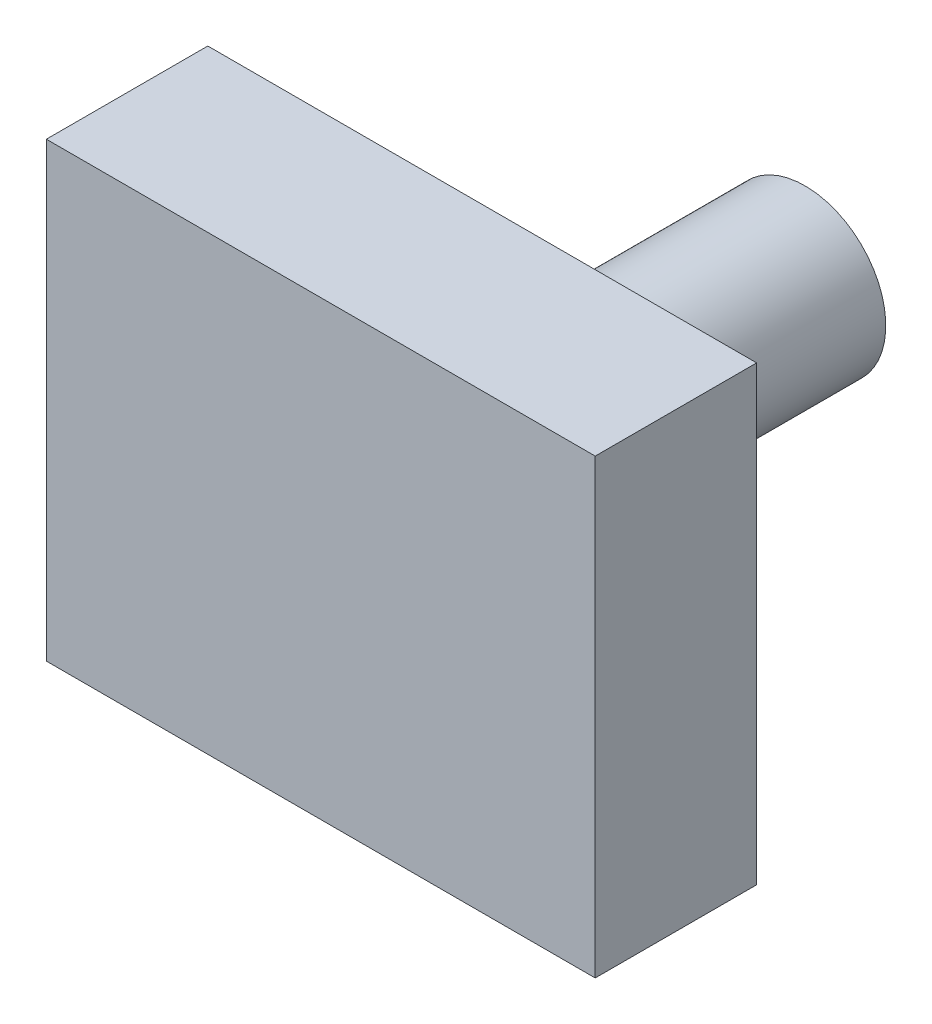
from build123d import *

# Parameters (mm, degrees)
ESQUISSE1_W        = 17
ESQUISSE1_H        = 14
BOSS_EXTRU_1_DEPTH = 5
ESQUISSE2_R        = 2.5
BOSS_EXTRU_2_DEPTH = 10


with BuildPart() as part:
    # Esquisse1 → Boss.-Extru.1 (new body)
    with BuildSketch(Plane.XY):
        Rectangle(ESQUISSE1_W, ESQUISSE1_H)
    extrude(amount=BOSS_EXTRU_1_DEPTH)

    # Esquisse2 → Boss.-Extru.2 (add)
    with BuildSketch(Plane(origin=(0, 0, 0), x_dir=(-1, 0, 0), z_dir=(0, 0, -1))):
        Circle(ESQUISSE2_R)
    extrude(amount=BOSS_EXTRU_2_DEPTH)


solid = part.part
